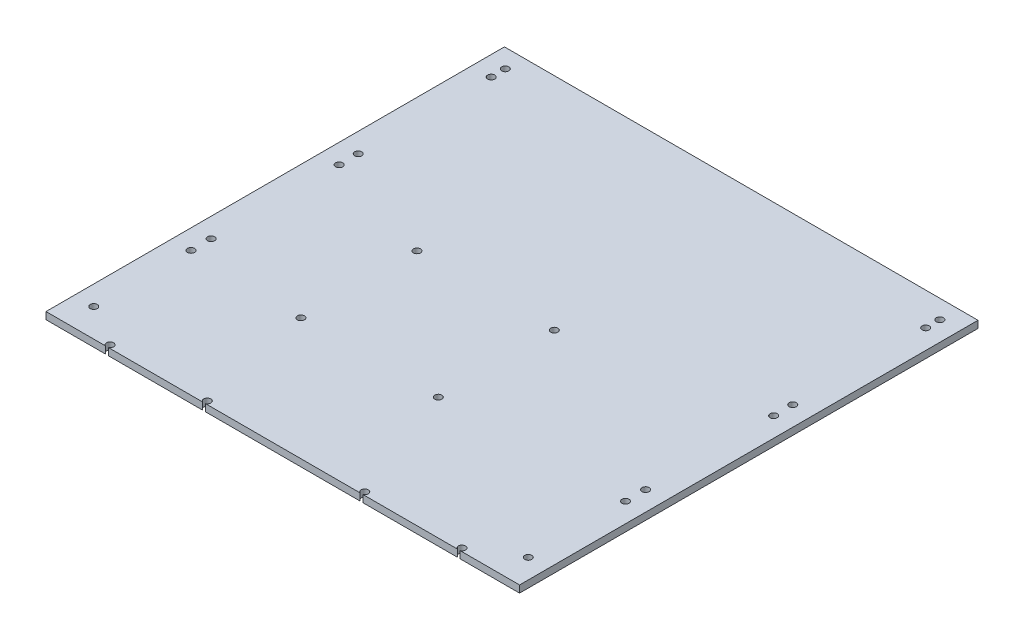
from build123d import *

# Parameters (mm, degrees)
SKETCH_1_W          = 200
SKETCH_1_H          = 140
EXTRUDE_1_DEPTH     = 3
SKETCH_2_R          = 1.5
SKETCH_2_W          = 160
SKETCH_2_H          = 130.210911355
CUT_EXTRUDE_1_DEPTH = 6
SKETCH_3_W          = 18.058491918
SKETCH_3_H          = 53.614911852
EXTRUDE_2_DEPTH     = 3
SKETCH_4_R          = 1.5
CUT_EXTRUDE_2_DEPTH = 3
SKETCH_5_W          = 160
SKETCH_5_H          = 3
EXTRUDE_3_DEPTH     = 130.210911355
SKETCH_6_W          = 163.883016164
SKETCH_6_H          = 3
EXTRUDE_5_DEPTH     = 53.614911852
SKETCH_7_R          = 1.5
CUT_EXTRUDE_3_DEPTH = 5
SKETCH_8_R          = 1.5
CUT_EXTRUDE_4_DEPTH = 3
SKETCH_9_R          = 1.5
CUT_EXTRUDE_5_DEPTH = 3


with BuildPart() as part:
    # 草图1 → 凸台-拉伸1 (new body)
    with BuildSketch(Plane(origin=(0, 0, 0), x_dir=(1, 0, 0), z_dir=(0, 1, 0))):
        Rectangle(SKETCH_1_W, SKETCH_1_H)
    extrude(amount=EXTRUDE_1_DEPTH)

    # 草图2 → 切除-拉伸1 (cut)
    with BuildSketch(Plane.XZ):
        with Locations(Location((91.756220162, -62.130143817, 0), (0, 0, 270))):
            Circle(SKETCH_2_R)
        with Locations(Location((-91.756220162, -62.130143817, 0), (0, 0, 90))):
            Circle(SKETCH_2_R)
        with Locations(Location((91.756220162, 62.130143817, 0), (0, 0, 90))):
            Circle(SKETCH_2_R)
        with Locations(Location((-91.756220162, 62.130143817, 0), (0, 0, 270))):
            Circle(SKETCH_2_R)
        with Locations(Location((-91.756220162, 0, 0), (0, 0, 270))):
            Circle(SKETCH_2_R)
        with Locations(Location((91.756220162, 0, 0), (0, 0, 90))):
            Circle(SKETCH_2_R)
        with Locations((0, -4.894544322)):
            Rectangle(SKETCH_2_W, SKETCH_2_H)
    extrude(amount=-CUT_EXTRUDE_1_DEPTH, mode=Mode.SUBTRACT)

    # 草图3 → 凸台-拉伸2 (add)
    with BuildSketch(Plane(origin=(0, 3, 0), x_dir=(1, 0, 0), z_dir=(0, 1, 0))):
        with Locations((90.970754041, -96.807455926)):
            Rectangle(SKETCH_3_W, SKETCH_3_H)
        with Locations((-90.970754041, -96.807455926)):
            Rectangle(SKETCH_3_W, SKETCH_3_H)
    extrude(amount=-EXTRUDE_2_DEPTH)

    # 草图4 → 切除-拉伸2 (cut)
    with BuildSketch(Plane(origin=(0, 3, 0), x_dir=(1, 0, 0), z_dir=(0, 1, 0))):
        with Locations(Location((-91.756220162, -111.691638535, 0), (0, 0, 270))):
            Circle(SKETCH_4_R)
        with Locations(Location((91.756220162, -111.691638535, 0), (0, 0, 90))):
            Circle(SKETCH_4_R)
    extrude(amount=-CUT_EXTRUDE_2_DEPTH, mode=Mode.SUBTRACT)

    # 草图5 → 凸台-拉伸3 (add)
    with BuildSketch(Plane(origin=(0, 0, 60.210911355), x_dir=(-1, 0, 0), z_dir=(0, 0, -1))):
        with Locations((0, 1.5)):
            Rectangle(SKETCH_5_W, SKETCH_5_H)
    extrude(amount=EXTRUDE_3_DEPTH)

    # 草图6 → 凸台-拉伸5 (add)
    with BuildSketch(Plane.XY.offset(70)):
        with Locations((0, 1.5)):
            Rectangle(SKETCH_6_W, SKETCH_6_H)
    extrude(amount=EXTRUDE_5_DEPTH)

    # 草图7 → 切除-拉伸3 (cut)
    with BuildSketch(Plane(origin=(0, 3, 0), x_dir=(1, 0, 0), z_dir=(0, 1, 0))):
        with Locations((-74.307985478, -122.25026612)):
            Circle(SKETCH_7_R)
        with Locations((-33.249974851, -122.25026612)):
            Circle(SKETCH_7_R)
        with Locations((33.249974851, -122.25026612)):
            Circle(SKETCH_7_R)
        with Locations((74.307985478, -122.25026612)):
            Circle(SKETCH_7_R)
    extrude(amount=-CUT_EXTRUDE_3_DEPTH, mode=Mode.SUBTRACT)

    # 草图8 → 切除-拉伸4 (cut)
    with BuildSketch(Plane(origin=(0, 3, 0), x_dir=(1, 0, 0), z_dir=(0, 1, 0))):
        with Locations(Location((14.144450177, -23.083468073, 0), (0, 0, 270))):
            Circle(SKETCH_8_R)
        with Locations(Location((-43.855549823, -23.083468073, 0), (0, 0, 270))):
            Circle(SKETCH_8_R)
        with Locations(Location((-43.855549823, -72.083468073, 0), (0, 0, 270))):
            Circle(SKETCH_8_R)
        with Locations(Location((14.144450177, -72.083468073, 0), (0, 0, 270))):
            Circle(SKETCH_8_R)
    extrude(amount=-CUT_EXTRUDE_4_DEPTH, mode=Mode.SUBTRACT)

    # 草图9 → 切除-拉伸5 (cut)
    with BuildSketch(Plane(origin=(0, 3, 0), x_dir=(1, 0, 0), z_dir=(0, 1, 0))):
        with Locations(Location((-91.756220162, -70.625190386, 0), (0, 0, 270))):
            Circle(SKETCH_9_R)
        with Locations(Location((-91.756220162, -8.060389113, 0), (0, 0, 270))):
            Circle(SKETCH_9_R)
        with Locations(Location((-91.756220162, 56.163438047, 0), (0, 0, 270))):
            Circle(SKETCH_9_R)
        with Locations(Location((91.756220162, 56.163438047, 0), (0, 0, 90))):
            Circle(SKETCH_9_R)
        with Locations(Location((91.756220162, -8.060389113, 0), (0, 0, 90))):
            Circle(SKETCH_9_R)
        with Locations(Location((91.756220162, -70.625190386, 0), (0, 0, 90))):
            Circle(SKETCH_9_R)
    extrude(amount=-CUT_EXTRUDE_5_DEPTH, mode=Mode.SUBTRACT)


solid = part.part
